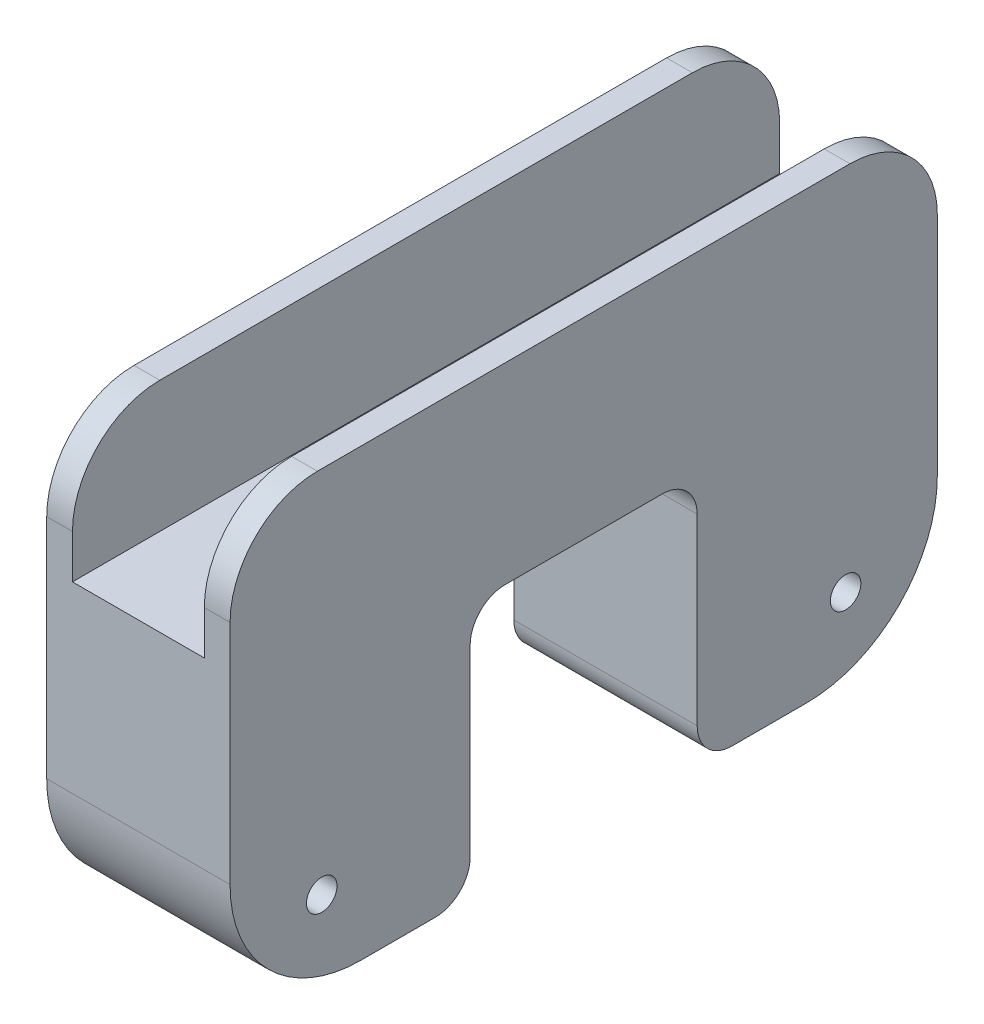
from build123d import *

# Parameters (mm, degrees)
EXTRUDE_1_DEPTH     = 81
SKETCH_2_R          = 2.25
CUT_EXTRUDE_1_DEPTH = 82
SKETCH_3_R          = 1.75
CUT_EXTRUDE_2_DEPTH = 82
FILLET_1_R          = 10
FILLET_3_R          = 15
SKETCH_6_W          = 13
SKETCH_6_H          = 29
CUT_EXTRUDE_3_DEPTH = 55
FILLET_4_R          = 4


with BuildPart() as part:
    # 草图1 → 凸台-拉伸1 (new body)
    with BuildSketch(Plane.XY):
        Polygon((18.05, -15), (10.5, -15), (10.5, -51), (21, -51), (21, 0), (18.05, 0), align=None)
        Polygon((10.5, -51), (10.5, -15), (2.95, -15), (2.95, 0), (0, 0), (0, -51), align=None)
    extrude(amount=EXTRUDE_1_DEPTH)

    # 草图2 → 切除-拉伸1 (cut)
    with BuildSketch(Plane.XZ.offset(51)):
        with Locations(Location((10.5, 20.5, 0), (0, 0, 270))):
            Circle(SKETCH_2_R)
        with Locations(Location((10.5, 60.5, 0), (0, 0, 270))):
            Circle(SKETCH_2_R)
    extrude(amount=-CUT_EXTRUDE_1_DEPTH, mode=Mode.SUBTRACT)

    # 草图3 → 切除-拉伸2 (cut)
    with BuildSketch(Plane(origin=(21, 0, 0), x_dir=(0, 0, -1), z_dir=(1, 0, 0))):
        with Locations(Location((-70.5, -42.25, 0), (0, 0, 90))):
            Circle(SKETCH_3_R)
        with Locations(Location((-10.5, -42.25, 0), (0, 0, 90))):
            Circle(SKETCH_3_R)
    extrude(amount=-CUT_EXTRUDE_2_DEPTH, mode=Mode.SUBTRACT)

    # 圆角1
    fillet_1_edges = [part.edges().sort_by_distance(p)[0] for p in [
        (19.525, 0, 0),
        (1.475, 0, 0),
        (1.475, 0, 81),
        (19.525, 0, 81),
    ]]
    fillet(fillet_1_edges, radius=FILLET_1_R)

    # 圆角3
    fillet_3_edges = [part.edges().sort_by_distance(p)[0] for p in [
        (10.5, -51, 0),
        (10.5, -51, 81),
    ]]
    fillet(fillet_3_edges, radius=FILLET_3_R)

    # 草图6 → 切除-拉伸3 (cut)
    with BuildSketch(Plane(origin=(21, 0, 0), x_dir=(0, 0, -1), z_dir=(1, 0, 0))):
        with Locations((-34, -36.5)):
            Rectangle(SKETCH_6_W, SKETCH_6_H)
        with Locations((-47, -36.5)):
            Rectangle(SKETCH_6_W, SKETCH_6_H)
    extrude(amount=-CUT_EXTRUDE_3_DEPTH, mode=Mode.SUBTRACT)

    # 圆角4
    fillet_4_edges = [part.edges().sort_by_distance(p)[0] for p in [
        (10.5, -22, 53.5),
        (10.5, -22, 27.5),
        (10.5, -51, 27.5),
        (10.5, -51, 53.5),
    ]]
    fillet(fillet_4_edges, radius=FILLET_4_R)


solid = part.part
